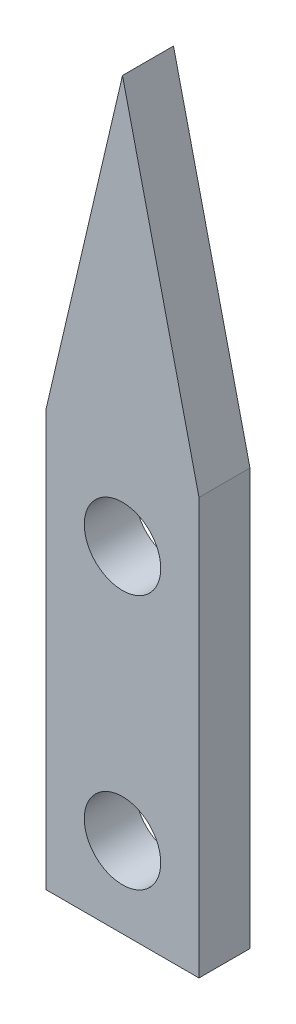
from build123d import *

# Parameters (mm, degrees)
SKETCH_1_R      = 1.5
EXTRUDE_1_DEPTH = 2


with BuildPart() as part:
    # 草图1 → 凸台-拉伸1 (new body)
    with BuildSketch(Plane.XY):
        Polygon((3, 3.164176285), (0, 16), (-3, 3.164176285), (-3, -13.164176285), (3, -13.164176285), align=None)
        Circle(SKETCH_1_R, mode=Mode.SUBTRACT)
        with Locations((0, -10)):
            Circle(SKETCH_1_R, mode=Mode.SUBTRACT)
    extrude(amount=EXTRUDE_1_DEPTH)


solid = part.part
